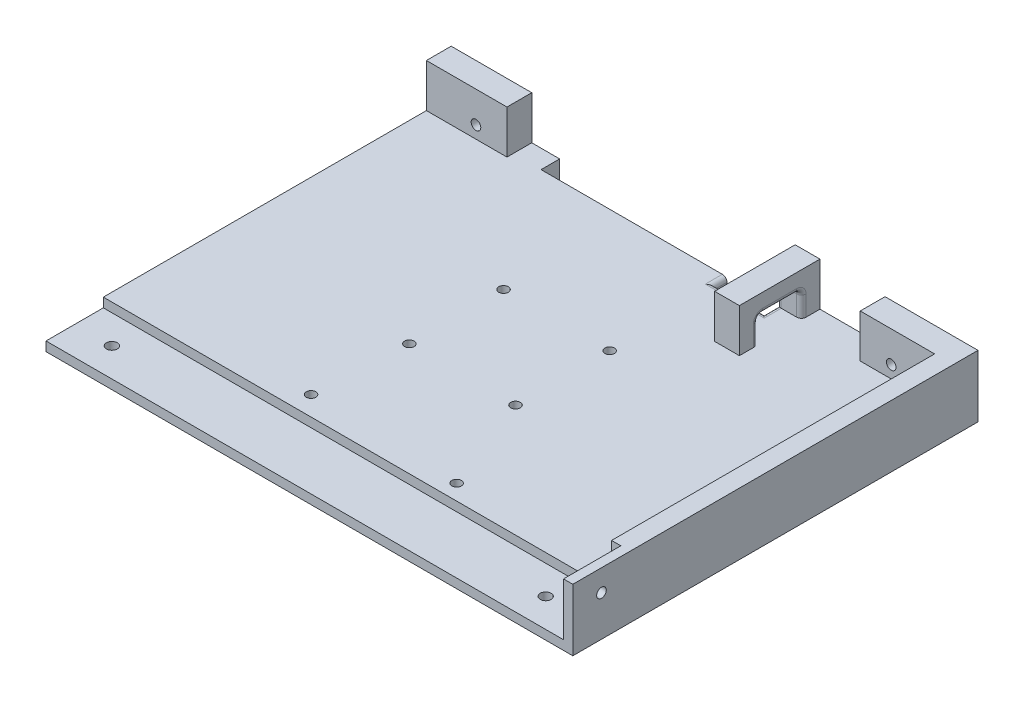
from build123d import *

# Parameters (mm, degrees)
BOSS_EXTRUDE1_DEPTH = 6
SKETCH2_W           = 26
SKETCH2_H           = 8
SKETCH2_W_2         = 30
BOSS_EXTRUDE2_DEPTH = 14
SKETCH3_R           = 1.55
CUT_EXTRUDE1_DEPTH  = 151.6405075
SKETCH4_W           = 170
SKETCH4_H           = 18.5
CUT_EXTRUDE2_DEPTH  = 3
SKETCH5_R           = 1.75
CUT_EXTRUDE3_DEPTH  = 3
BOSS_EXTRUDE3_REACH = 111.082
SKETCH8_R           = 1.55
CUT_EXTRUDE4_DEPTH  = 181.451906682
CUT_EXTRUDE5_REACH  = 110.143
SKETCH9_W           = 16
SKETCH9_H           = 10
SKETCH10_W          = 8
SKETCH10_H          = 26
BOSS_EXTRUDE4_DEPTH = 14
CUT_EXTRUDE6_REACH  = 139.24
FILLET1_R           = 1.5
SKETCH12_R          = 1.55
CUT_EXTRUDE7_DEPTH  = 14
CUT_EXTRUDE8_REACH  = 110.143
SKETCH13_R          = 1.55


with BuildPart() as part:
    # Sketch1 → Boss-Extrude1 (new body)
    with BuildSketch(Plane(origin=(0, 0, 0), x_dir=(1, 0, 0), z_dir=(0, 1, 0))):
        Polygon((-85, 65.375), (-85, -65.375), (85, -65.375), (85, 65.375), (10, 65.375), (10, 59.375), (-50, 59.375), (-50, 65.375), align=None)
    extrude(amount=BOSS_EXTRUDE1_DEPTH)

    # Sketch2 → Boss-Extrude2 (add)
    with BuildSketch(Plane(origin=(0, 6, 0), x_dir=(1, 0, 0), z_dir=(0, 1, 0))):
        with Locations((-72, 61.375)):
            Rectangle(SKETCH2_W, SKETCH2_H)
        with Locations((70, 61.375)):
            Rectangle(SKETCH2_W_2, SKETCH2_H)
    extrude(amount=BOSS_EXTRUDE2_DEPTH)

    # Sketch3 → Cut-Extrude1 (cut, through all)
    with BuildSketch(Plane.XY.offset(-57.375)):
        with Locations((-69, 10)):
            Circle(SKETCH3_R)
        with Locations((65, 10)):
            Circle(SKETCH3_R)
    extrude(amount=-CUT_EXTRUDE1_DEPTH, mode=Mode.SUBTRACT)

    # Sketch4 → Cut-Extrude2 (cut)
    with BuildSketch(Plane(origin=(0, 6, 0), x_dir=(1, 0, 0), z_dir=(0, 1, 0))):
        with Locations((0, -56.125)):
            Rectangle(SKETCH4_W, SKETCH4_H)
    extrude(amount=-CUT_EXTRUDE2_DEPTH, mode=Mode.SUBTRACT)

    # Sketch5 → Cut-Extrude3 (cut)
    with BuildSketch(Plane(origin=(0, 3, 0), x_dir=(1, 0, 0), z_dir=(0, 1, 0))):
        with Locations(Location((-73, -56.125, 0), (0, 0, 270))):
            Circle(SKETCH5_R)
        with Locations(Location((67, -56.125, 0), (0, 0, 270))):
            Circle(SKETCH5_R)
    extrude(amount=-CUT_EXTRUDE3_DEPTH, mode=Mode.SUBTRACT)

    # Sketch7 → Boss-Extrude3 (add, up to next)
    with BuildSketch(Plane(origin=(0, 20, 0), x_dir=(1, 0, 0), z_dir=(0, 1, 0)), mode=Mode.PRIVATE) as boss_extrude3_sk1:
        Polygon((85, -65.375), (85, 57.375), (79, 57.375), (79, -46.875), (82, -46.875), (82, -65.375), align=None)
    boss_extrude3_tool1 = extrude(boss_extrude3_sk1.sketch, amount=-BOSS_EXTRUDE3_REACH, mode=Mode.PRIVATE) - part.part
    add(boss_extrude3_tool1.solids().sort_by_distance((82.122247, 20, -0.248073))[0])

    # Sketch8 → Cut-Extrude4 (cut, through all)
    with BuildSketch(Plane.ZY.offset(-82)):
        with Locations((56.125, 13)):
            Circle(SKETCH8_R)
    extrude(amount=-CUT_EXTRUDE4_DEPTH, mode=Mode.SUBTRACT)

    # Sketch9 → Cut-Extrude5 (cut, up to next)
    with BuildSketch(Plane(origin=(0, 6, 0), x_dir=(1, 0, 0), z_dir=(0, 1, 0)), mode=Mode.PRIVATE) as cut_extrude5_sk1:
        with Locations((18, 60.375)):
            Rectangle(SKETCH9_W, SKETCH9_H)
    cut_extrude5_tool1 = extrude(cut_extrude5_sk1.sketch, amount=-CUT_EXTRUDE5_REACH, mode=Mode.PRIVATE) & part.part
    add(cut_extrude5_tool1.solids().sort_by_distance((18, 6, -60.375))[0], mode=Mode.SUBTRACT)

    # Sketch10 → Boss-Extrude4 (add)
    with BuildSketch(Plane(origin=(0, 6, 0), x_dir=(1, 0, 0), z_dir=(0, 1, 0))):
        with Locations((30, 52.375)):
            Rectangle(SKETCH10_W, SKETCH10_H)
    extrude(amount=BOSS_EXTRUDE4_DEPTH)

    # Sketch11 → Cut-Extrude6 (cut, up to next)
    with BuildSketch(Plane(origin=(34, 0, 0), x_dir=(0, 0, -1), z_dir=(1, 0, 0)), mode=Mode.PRIVATE) as cut_extrude6_sk1:
        Polygon((45.375, 12), (45.375, 6), (59.375, 6), (59.375, 12), (59.375, 14), (45.375, 14), align=None)
    cut_extrude6_tool1 = extrude(cut_extrude6_sk1.sketch, amount=-CUT_EXTRUDE6_REACH, mode=Mode.PRIVATE) & part.part
    add(cut_extrude6_tool1.solids().sort_by_distance((34, 10, -52.375))[0], mode=Mode.SUBTRACT)

    # Fillet1
    fillet1_edges = [part.edges().sort_by_distance(p)[0] for p in [
        (26, 6, -57.375),
        (18, 6, -55.375),
        (10, 6, -57.375),
        (26, 10, -45.375),
        (26, 14, -52.375),
        (26, 10, -59.375),
        (34, 10, -59.375),
        (34, 14, -52.375),
        (34, 10, -45.375),
        (30, 14, -45.375),
        (30, 14, -59.375),
    ]]
    fillet(fillet1_edges, radius=FILLET1_R)

    # Sketch12 → Cut-Extrude7 (cut)
    with BuildSketch(Plane(origin=(0, 6, 0), x_dir=(1, 0, 0), z_dir=(0, 1, 0))):
        with Locations(Location((24, -41.875, 0), (0, 0, 270))):
            Circle(SKETCH12_R)
        with Locations(Location((-24.26, -40.575, 0), (0, 0, 270))):
            Circle(SKETCH12_R)
    extrude(amount=-CUT_EXTRUDE7_DEPTH, mode=Mode.SUBTRACT)

    # Sketch13 → Cut-Extrude8 (cut, up to next)
    with BuildSketch(Plane(origin=(0, 6, 0), x_dir=(1, 0, 0), z_dir=(0, 1, 0)), mode=Mode.PRIVATE) as cut_extrude8_sk1:
        with Locations(Location((11.685222517, 19.828524859, 0), (0, 0, 270))):
            Circle(SKETCH13_R)
    cut_extrude8_tool1 = extrude(cut_extrude8_sk1.sketch, amount=-CUT_EXTRUDE8_REACH, mode=Mode.PRIVATE) & part.part
    # Sketch13 → Cut-Extrude8 (cut, up to next)
    with BuildSketch(Plane(origin=(0, 6, 0), x_dir=(1, 0, 0), z_dir=(0, 1, 0)), mode=Mode.PRIVATE) as cut_extrude8_sk2:
        with Locations(Location((-22.560396417, 19.828524859, 0), (0, 0, 270))):
            Circle(SKETCH13_R)
    cut_extrude8_tool2 = extrude(cut_extrude8_sk2.sketch, amount=-CUT_EXTRUDE8_REACH, mode=Mode.PRIVATE) & part.part
    # Sketch13 → Cut-Extrude8 (cut, up to next)
    with BuildSketch(Plane(origin=(0, 6, 0), x_dir=(1, 0, 0), z_dir=(0, 1, 0)), mode=Mode.PRIVATE) as cut_extrude8_sk3:
        with Locations(Location((11.685222517, -10.544533108, 0), (0, 0, 270))):
            Circle(SKETCH13_R)
    cut_extrude8_tool3 = extrude(cut_extrude8_sk3.sketch, amount=-CUT_EXTRUDE8_REACH, mode=Mode.PRIVATE) & part.part
    # Sketch13 → Cut-Extrude8 (cut, up to next)
    with BuildSketch(Plane(origin=(0, 6, 0), x_dir=(1, 0, 0), z_dir=(0, 1, 0)), mode=Mode.PRIVATE) as cut_extrude8_sk4:
        with Locations(Location((-22.560396417, -10.544533108, 0), (0, 0, 270))):
            Circle(SKETCH13_R)
    cut_extrude8_tool4 = extrude(cut_extrude8_sk4.sketch, amount=-CUT_EXTRUDE8_REACH, mode=Mode.PRIVATE) & part.part
    add(cut_extrude8_tool1.solids().sort_by_distance((11.685223, 6, -19.828525))[0], mode=Mode.SUBTRACT)
    add(cut_extrude8_tool2.solids().sort_by_distance((-22.560396, 6, -19.828525))[0], mode=Mode.SUBTRACT)
    add(cut_extrude8_tool3.solids().sort_by_distance((11.685223, 6, 10.544533))[0], mode=Mode.SUBTRACT)
    add(cut_extrude8_tool4.solids().sort_by_distance((-22.560396, 6, 10.544533))[0], mode=Mode.SUBTRACT)


solid = part.part
